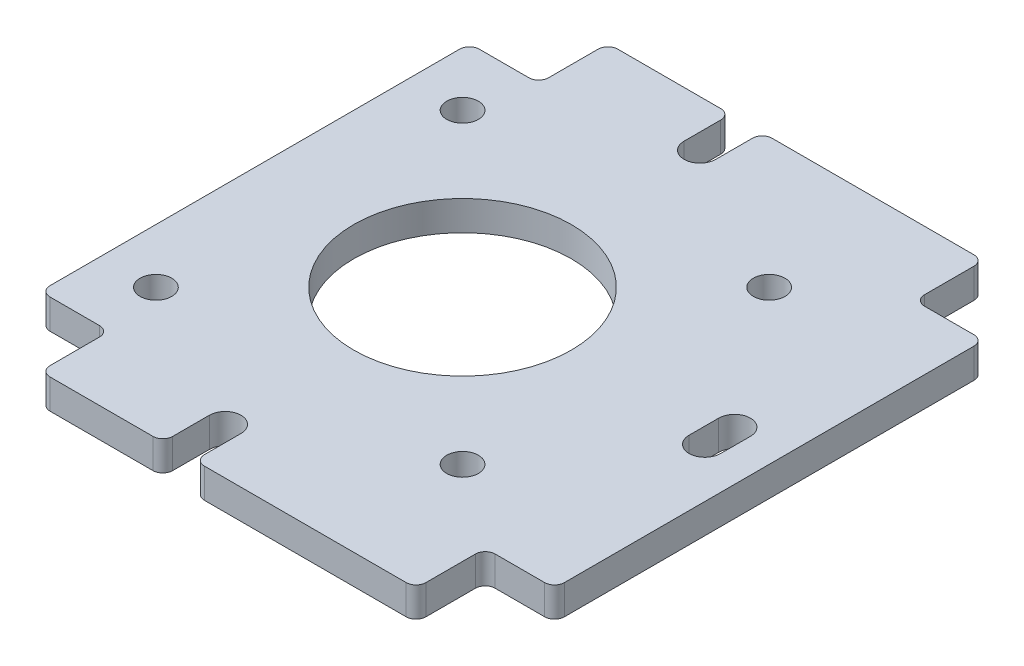
from build123d import *

# Parameters (mm, degrees)
SKETCH1_W            = 42
SKETCH1_H            = 42
SKETCH1_R            = 11
BOSS_EXTRUDE1_DEPTH  = 1.5
M3_CLEARANCE_HOLE1_D = 3.2
SKETCH4_W            = 10
SKETCH4_H            = 28
BOSS_EXTRUDE2_DEPTH  = 3
SKETCH5_W            = 7
SKETCH5_H            = 0.7
BOSS_EXTRUDE3_DEPTH  = 3
FILLET1_R            = 1


with BuildPart() as part:
    # Sketch1 → Boss-Extrude1 (new, symmetric)
    with BuildSketch(Plane(origin=(0, 0, 0), x_dir=(1, 0, 0), z_dir=(0, 1, 0))):
        Rectangle(SKETCH1_W, SKETCH1_H)
        with Locations(Location((0, 0, 0), (0, 0, 270))):
            Circle(SKETCH1_R, mode=Mode.SUBTRACT)
    extrude(amount=BOSS_EXTRUDE1_DEPTH, both=True)

    # M3 Clearance Hole1 (through all)
    with Locations(Plane(origin=(0, 1.5, 0), x_dir=(1, 0, 0), z_dir=(0, 1, 0))):
        with Locations((-15.5, 15.5), (15.5, 15.5), (15.5, -15.5), (-15.5, -15.5)):
            Hole(M3_CLEARANCE_HOLE1_D / 2)

    # Sketch4 → Boss-Extrude2 (add)
    # profile 1 of 3: a face of its own
    with BuildSketch(Plane(origin=(0, 1.5, 0), x_dir=(1, 0, 0), z_dir=(0, 1, 0))):
        with BuildLine():
            Line((1.6, -24), (1.6, -28.7))
            Line((1.6, -28.7), (14, -28.7))
            Line((14, -28.7), (14, -21))
            Line((14, -21), (-14, -21))
            Line((-14, -21), (-14, -28.7))
            Line((-14, -28.7), (-1.6, -28.7))
            Line((-1.6, -28.7), (-1.6, -24))
            ThreePointArc((-1.6, -24), (0, -22.4), (1.6, -24))
        make_face()
    # profile 2 of 3: a face of its own
    with BuildSketch(Plane(origin=(0, 1.5, 0), x_dir=(1, 0, 0), z_dir=(0, 1, 0))):
        with BuildLine():
            Line((1.6, 28.7), (14, 28.7))
            Line((14, 28.7), (14, 21))
            Line((14, 21), (-14, 21))
            Line((-14, 21), (-14, 28.7))
            Line((-14, 28.7), (-1.6, 28.7))
            Line((-1.6, 28.7), (-1.6, 24))
            ThreePointArc((-1.6, 24), (0, 22.4), (1.6, 24))
            Line((1.6, 24), (1.6, 28.7))
        make_face()
    # profile 3 of 3: a face of its own
    with BuildSketch(Plane(origin=(0, 1.5, 0), x_dir=(1, 0, 0), z_dir=(0, 1, 0))):
        with Locations((26, 0)):
            Rectangle(SKETCH4_W, SKETCH4_H)
        with BuildLine():
            Line((27.6, 1.5), (27.6, -1.5))
            ThreePointArc((27.6, -1.5), (26, -3.1), (24.4, -1.5))
            Line((24.4, -1.5), (24.4, 1.5))
            ThreePointArc((24.4, 1.5), (26, 3.1), (27.6, 1.5))
        make_face(mode=Mode.SUBTRACT)
    extrude(amount=-BOSS_EXTRUDE2_DEPTH)

    # Sketch5 → Boss-Extrude3 (add)
    with BuildSketch(Plane(origin=(0, 1.5, 0), x_dir=(1, 0, 0), z_dir=(0, 1, 0))):
        Polygon((21, 14), (31, 14), (31, 21.7), (24, 21.7), (24, 28.7), (14, 28.7), (14, 21), (21, 21), align=None)
        Polygon((31, -14), (21, -14), (21, -21), (14, -21), (14, -28.7), (24, -28.7), (24, -21.7), (31, -21.7), align=None)
        with Locations((-17.5, -21.35)):
            Rectangle(SKETCH5_W, SKETCH5_H)
        with Locations((-17.5, 21.35)):
            Rectangle(SKETCH5_W, SKETCH5_H)
    extrude(amount=-BOSS_EXTRUDE3_DEPTH)

    # Fillet1
    fillet1_edges = [part.edges().sort_by_distance(p)[0] for p in [
        (-21, 0, 21.7),
        (31, 0, -21.7),
        (-21, 0, -21.7),
        (-14, 0, -21.7),
        (24, 0, -28.7),
        (24, 0, -21.7),
        (31, 0, 21.7),
        (24, 0, 21.7),
        (24, 0, 28.7),
        (-14, 0, 21.7),
        (-1.6, 0, 28.7),
        (-14, 0, 28.7),
        (1.6, 0, 28.7),
        (1.6, 0, -28.7),
        (-14, 0, -28.7),
        (-1.6, 0, -28.7),
    ]]
    fillet(fillet1_edges, radius=FILLET1_R)


solid = part.part
